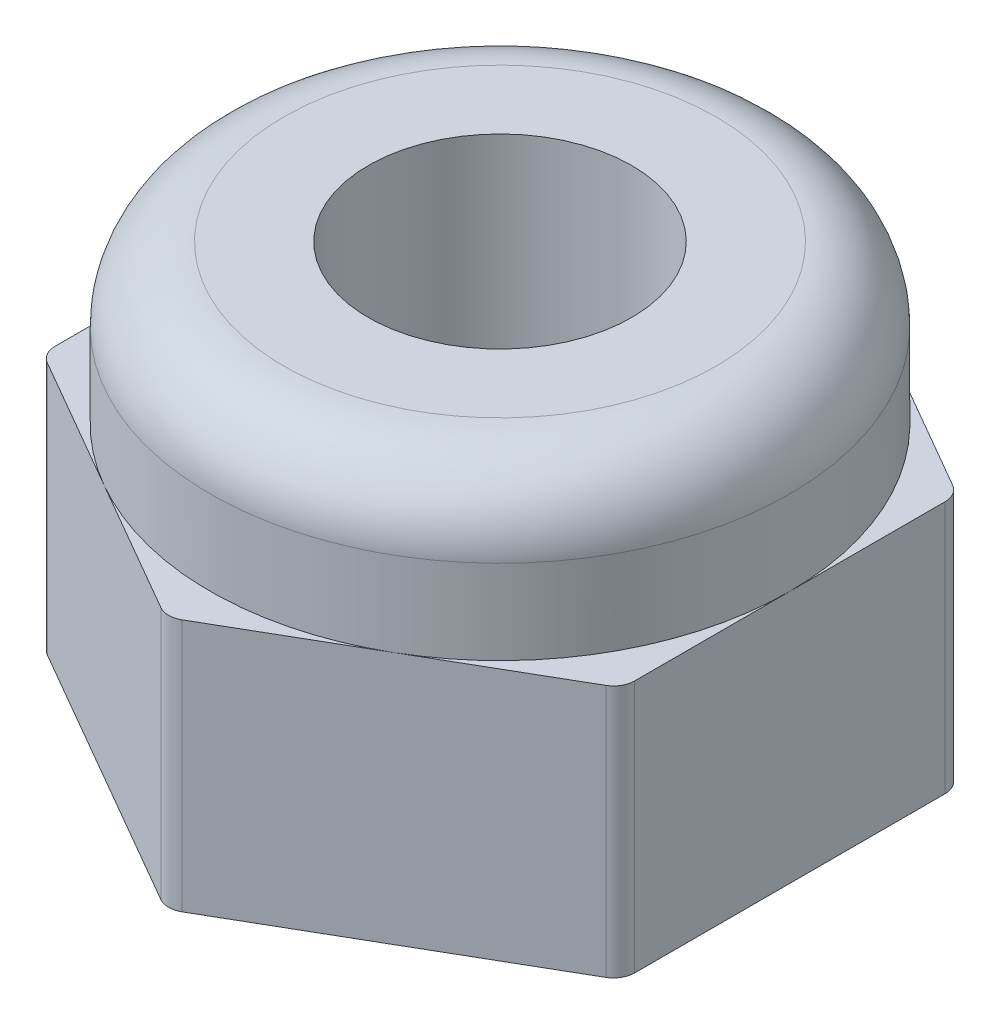
from build123d import *

# Parameters (mm, degrees)
EXTRUDE_1_DEPTH        = 2.4
SKETCH_2_R             = 2.75
EXTRUDE_2_DEPTH        = 3.9
FILLET_1_R             = 0.7
FILLET_2_R             = 0.2
HOLE_WIZARD_M3_1_D     = 2.5
HOLE_WIZARD_M3_1_DEPTH = 7.5
HOLE_WIZARD_M3_1_TIP   = 0.751075774


with BuildPart() as part:
    # 草图1 → 凸台-拉伸1 (new body)
    with BuildSketch(Plane(origin=(0, 0, 0), x_dir=(1, 0, 0), z_dir=(0, 1, 0))):
        Polygon((2.75, 1.58771324), (0, 3.175426481), (-2.75, 1.58771324), (-2.75, -1.58771324), (0, -3.175426481), (2.75, -1.58771324), align=None)
    extrude(amount=EXTRUDE_1_DEPTH)

    # 草图2 → 凸台-拉伸2 (add)
    with BuildSketch(Plane.XZ):
        with Locations(Location((0, 0, 0), (0, 0, 270))):
            Circle(SKETCH_2_R)
    extrude(amount=-EXTRUDE_2_DEPTH)

    # 圆角1
    fillet_1_edges = [part.edges().sort_by_distance(p)[0] for p in [
        (0, 3.9, 2.75),
    ]]
    fillet(fillet_1_edges, radius=FILLET_1_R)

    # 圆角2
    fillet_2_edges = [part.edges().sort_by_distance(p)[0] for p in [
        (2.75, 1.2, 1.58771324),
        (0, 1.2, 3.175426481),
        (-2.75, 1.2, 1.58771324),
        (-2.75, 1.2, -1.58771324),
        (0, 1.2, -3.175426481),
        (2.75, 1.2, -1.58771324),
    ]]
    fillet(fillet_2_edges, radius=FILLET_2_R)

    # M3 螺纹孔1
    with Locations(Plane(origin=(0, 0, 0), x_dir=(-1, 0, 0), z_dir=(0, -1, 0))):
        with Locations((0, 0)):
            Hole(HOLE_WIZARD_M3_1_D / 2, depth=HOLE_WIZARD_M3_1_DEPTH)
            with Locations((0, 0, -(HOLE_WIZARD_M3_1_DEPTH + HOLE_WIZARD_M3_1_TIP / 2))):  # 118° drill point
                Cone(0, HOLE_WIZARD_M3_1_D / 2, HOLE_WIZARD_M3_1_TIP, mode=Mode.SUBTRACT)


solid = part.part
